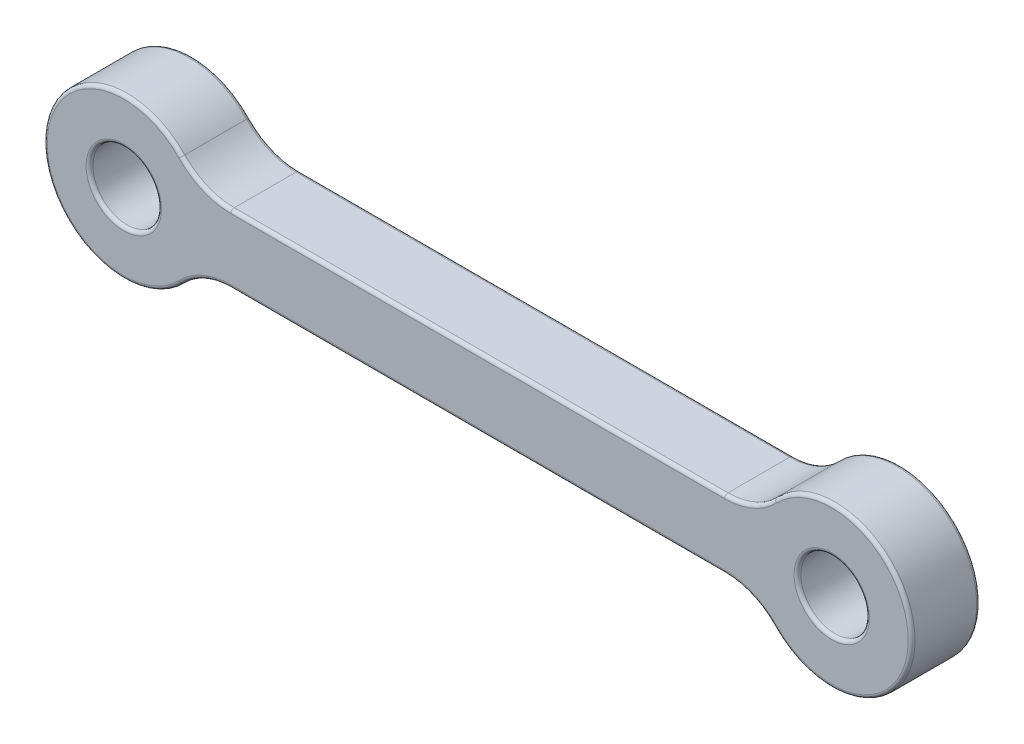
from build123d import *

# Parameters (mm, degrees)
SKETCH_1_R      = 3.5
SKETCH_1_R_2    = 1.5
EXTRUDE_1_DEPTH = 3
FILLET_1_R      = 3
FILLET_2_R      = 0.15
SCALE_1_SCALE   = 2.2


with BuildPart() as part:
    # Эскиз1 → Бобышка-Вытянуть1 (new body)
    # profile 1 of 3: a face of its own
    with BuildSketch(Plane.XY):
        Circle(SKETCH_1_R)
        Circle(SKETCH_1_R_2, mode=Mode.SUBTRACT)
    # profile 2 of 3: a face of its own
    with BuildSketch(Plane.XY):
        with BuildLine():
            Line((3.16227766, -1.5), (27.83772234, -1.5))
            ThreePointArc((27.83772234, -1.5), (27.5, 0), (27.83772234, 1.5))
            Line((27.83772234, 1.5), (3.16227766, 1.5))
            ThreePointArc((3.16227766, 1.5), (3.414525722, 0.768774411), (3.5, 0))
            ThreePointArc((3.5, 0), (3.414525722, -0.768774411), (3.16227766, -1.5))
        make_face()
    # profile 3 of 3: a face of its own
    with BuildSketch(Plane.XY):
        with Locations((31, 0)):
            Circle(SKETCH_1_R)
        with Locations((31, 0)):
            Circle(SKETCH_1_R_2, mode=Mode.SUBTRACT)
    extrude(amount=EXTRUDE_1_DEPTH)

    # Скругление1
    fillet_1_edges = [part.edges().sort_by_distance(p)[0] for p in [
        (3.16227766, 1.5, 1.5),
        (27.83772234, 1.5, 1.5),
        (27.83772234, -1.5, 1.5),
        (3.16227766, -1.5, 1.5),
    ]]
    fillet(fillet_1_edges, radius=FILLET_1_R)

    # Скругление2
    fillet_2_edges = [part.edges().sort_by_distance(p)[0] for p in [
        (-1.5, 0, 0),
        (15.5, 1.5, 0),
        (15.5, 1.5, 3),
        (34.5, 0, 0),
        (34.5, 0, 3),
        (-3.5, 0, 0),
        (-3.5, 0, 3),
        (15.5, -1.5, 0),
        (15.5, -1.5, 3),
        (27.486281051, 1.740401367, 0),
        (27.486281051, 1.740401367, 3),
        (3.513718949, 1.740401367, 0),
        (3.513718949, 1.740401367, 3),
        (29.5, 0, 3),
        (27.486281051, -1.740401367, 0),
        (27.486281051, -1.740401367, 3),
        (3.513718949, -1.740401367, 0),
        (3.513718949, -1.740401367, 3),
        (-1.5, 0, 3),
        (29.5, 0, 0),
    ]]
    fillet(fillet_2_edges, radius=FILLET_2_R)


with BuildPart() as part_1:
    # Масштаб1: scaled about (15.5, 0, 1.5)
    add(part.part.scale(SCALE_1_SCALE).moved(Location((-18.6, 0, -1.8))))


solid = part_1.part
